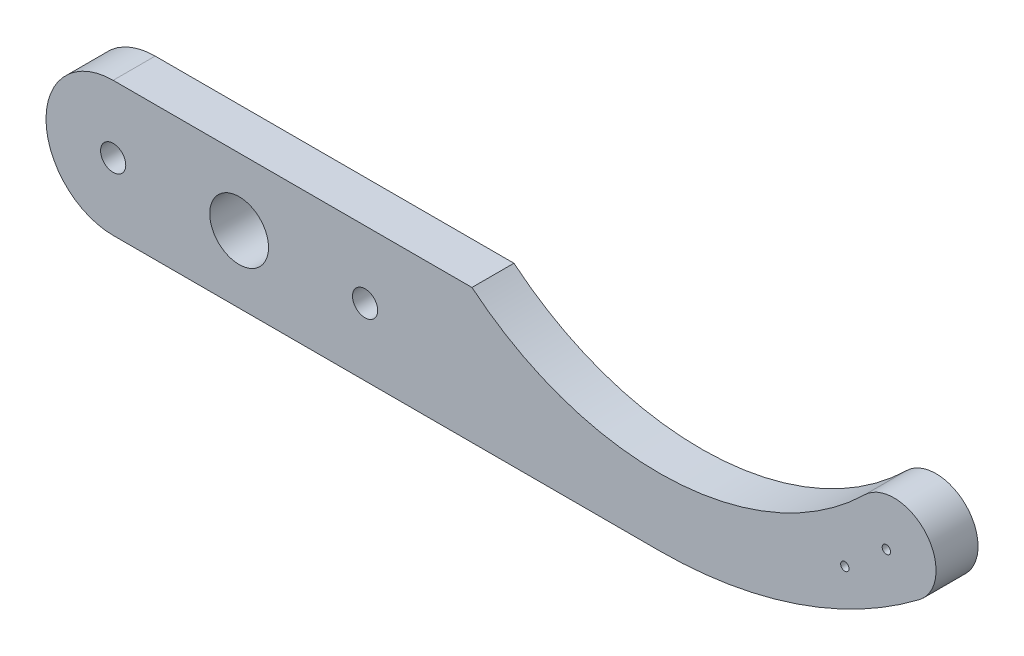
from build123d import *

# Parameters (mm, degrees)
ESQUISSE1_R        = 0.5
ESQUISSE1_R_2      = 1.5
ESQUISSE1_R_3      = 3.5
BOSS_EXTRU_1_DEPTH = 5


with BuildPart() as part:
    # Esquisse1 → Boss.-Extru.1 (new body)
    with BuildSketch(Plane.XY):
        with BuildLine():
            Line((0, 8), (20, 8))
            Line((20, 8), (27.728942549, 8))
            ThreePointArc((27.728942549, 8), (51.499017336, 0.032115491), (74.5, 10.0050005))
            ThreePointArc((74.5, 10.0050005), (81.783026213, 9.703645958), (81.02586797, 2.453818596))
            ThreePointArc((81.02586797, 2.453818596), (66.369841222, -5.316304031), (50, -8))
            Line((50, -8), (0, -8))
            Line((0, -8), (-15, -8))
            ThreePointArc((-15, -8), (-23, 0), (-15, 8))
            Line((-15, 8), (0, 8))
        make_face()
        with Locations((77.084290067, 5.654211565)):
            Circle(ESQUISSE1_R, mode=Mode.SUBTRACT)
        with Locations((15, 0)):
            Circle(ESQUISSE1_R_2, mode=Mode.SUBTRACT)
        with Locations((-15, 0)):
            Circle(ESQUISSE1_R_2, mode=Mode.SUBTRACT)
        Circle(ESQUISSE1_R_3, mode=Mode.SUBTRACT)
        with Locations((72.136277137, 1.439099698)):
            Circle(ESQUISSE1_R, mode=Mode.SUBTRACT)
    extrude(amount=BOSS_EXTRU_1_DEPTH)


solid = part.part
